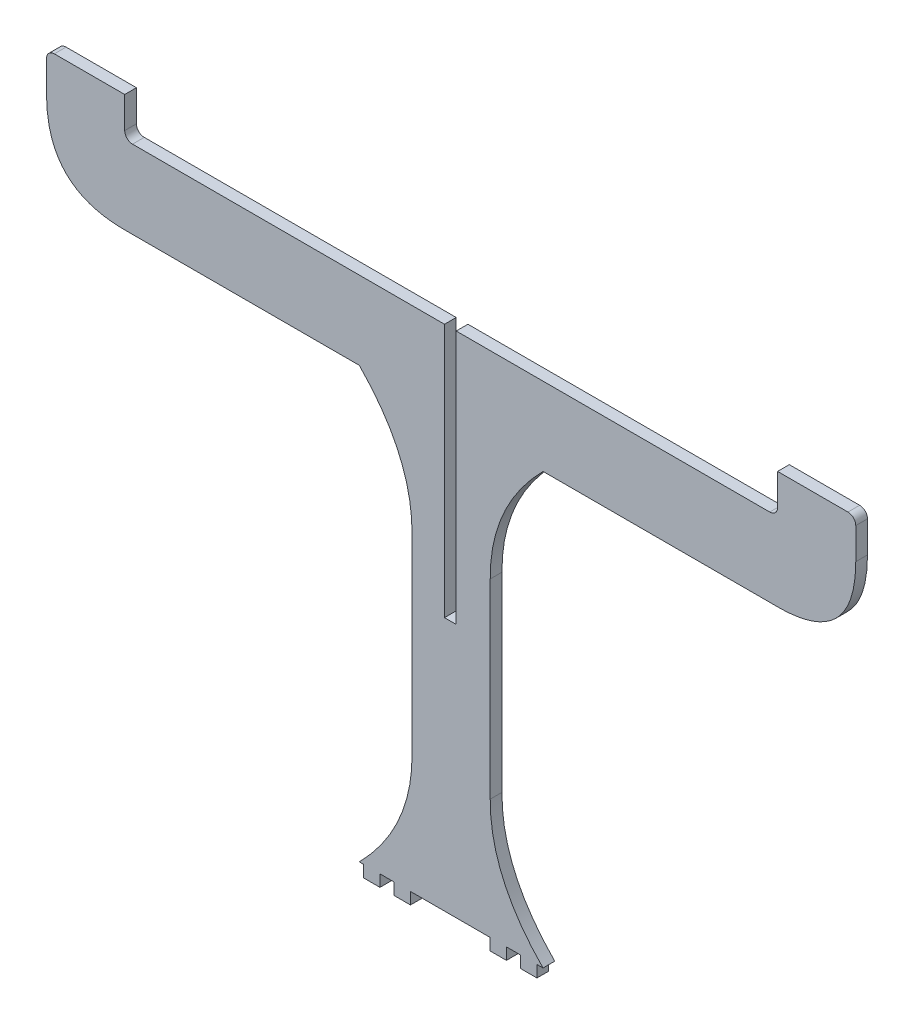
from build123d import *

# Parameters (mm, degrees)
P_IDAT_VYSUNUT_M2_DEPTH  = 3
SKICA2_W                 = 3
SKICA2_H                 = 65
ODEBRAT_VYSUNUT_M3_DEPTH = 3


with BuildPart() as part:
    # Skica1 → Přidat vysunutím2 (new body)
    with BuildSketch(Plane.XY):
        with BuildLine():
            Line((-90.642636358, 2.694256757), (-30.642636358, 2.694256757))
            add(Edge.make_bspline(
                [(-30.642636358, 2.694256757), (-17.025139471, -11.118063286), (-17.142636358, -27.878389443)],
                knots=[0, 0, 0, 1, 1, 1], degree=2))
            Line((-17.142636358, -27.878389443), (-17.142636358, -76.655981804))
            add(Edge.make_bspline(
                [(-30.642636358, -107.305743243), (-17.009316786, -93.458261678), (-17.142636358, -76.655981804)],
                knots=[0, 0, 0, 1, 1, 1], degree=2))
            Line((-30.642636358, -107.305743243), (-29.497972973, -107.305743243))
            Line((-29.497972973, -107.305743243), (-29.497972973, -110.305743243))
            Line((-29.497972973, -110.305743243), (-25.347972973, -110.305743243))
            Line((-25.347972973, -110.305743243), (-25.347972973, -107.305743243))
            Line((-25.347972973, -107.305743243), (-21.697972973, -107.305743243))
            Line((-21.697972973, -107.305743243), (-21.697972973, -110.305743243))
            Line((-21.697972973, -110.305743243), (-17.547972973, -110.305743243))
            Line((-17.547972973, -110.305743243), (-17.547972973, -107.305743243))
            Line((-17.547972973, -107.305743243), (2.852027027, -107.305743243))
            Line((2.852027027, -107.305743243), (2.852027027, -110.305743243))
            Line((2.852027027, -110.305743243), (7.002027027, -110.305743243))
            Line((7.002027027, -110.305743243), (7.002027027, -107.305743243))
            Line((7.002027027, -107.305743243), (10.652027027, -107.305743243))
            Line((10.652027027, -107.305743243), (10.652027027, -110.305743243))
            Line((10.652027027, -110.305743243), (14.802027027, -110.305743243))
            Line((14.802027027, -110.305743243), (14.802027027, -107.305743243))
            Line((14.802027027, -107.305743243), (16.357363642, -107.305743243))
            add(Edge.make_bspline(
                [(16.357363642, -107.305743243), (2.72404407, -93.458261678), (2.857363642, -76.655981804)],
                knots=[0, 0, 0, 1, 1, 1], degree=2))
            Line((2.857363642, -76.655981804), (2.857363642, -27.878389443))
            add(Edge.make_bspline(
                [(16.357363642, 2.694256757), (2.739866756, -11.118063286), (2.857363642, -27.878389443)],
                knots=[0, 0, 0, 1, 1, 1], degree=2))
            Line((16.357363642, 2.694256757), (76.357363642, 2.694256757))
            add(Edge.make_bspline(
                [(96.357363642, 22.694256757), (96.357363642, 2.694256757), (76.357363642, 2.694256757)],
                knots=[0, 0, 0, 1, 1, 1], degree=2))
            Line((96.357363642, 22.694256757), (96.357363642, 30.694256757))
            ThreePointArc((96.357363642, 30.694256757), (95.771577204, 32.108470319), (94.357363642, 32.694256757))
            Line((94.357363642, 32.694256757), (76.357363642, 32.694256757))
            Line((76.357363642, 32.694256757), (76.357363642, 24.694256757))
            ThreePointArc((76.357363642, 24.694256757), (75.771577204, 23.280043194), (74.357363642, 22.694256757))
            Line((74.357363642, 22.694256757), (-88.642636358, 22.694256757))
            ThreePointArc((-88.642636358, 22.694256757), (-90.05684992, 23.280043194), (-90.642636358, 24.694256757))
            Line((-90.642636358, 24.694256757), (-90.642636358, 32.694256757))
            Line((-90.642636358, 32.694256757), (-108.642636358, 32.694256757))
            ThreePointArc((-108.642636358, 32.694256757), (-110.05684992, 32.108470319), (-110.642636358, 30.694256757))
            Line((-110.642636358, 30.694256757), (-110.642636358, 22.694256757))
            add(Edge.make_bspline(
                [(-110.642636358, 22.694256757), (-110.642636358, 2.694256757), (-90.642636358, 2.694256757)],
                knots=[0, 0, 0, 1, 1, 1], degree=2))
        make_face()
    extrude(amount=P_IDAT_VYSUNUT_M2_DEPTH)

    # Skica2 → Odebrat vysunutím3 (cut)
    with BuildSketch(Plane(origin=(0, 0, 0), x_dir=(-1, 0, 0), z_dir=(0, 0, -1))):
        with Locations((7.347972973, -9.805743243)):
            Rectangle(SKICA2_W, SKICA2_H)
    extrude(amount=-ODEBRAT_VYSUNUT_M3_DEPTH, mode=Mode.SUBTRACT)


solid = part.part
